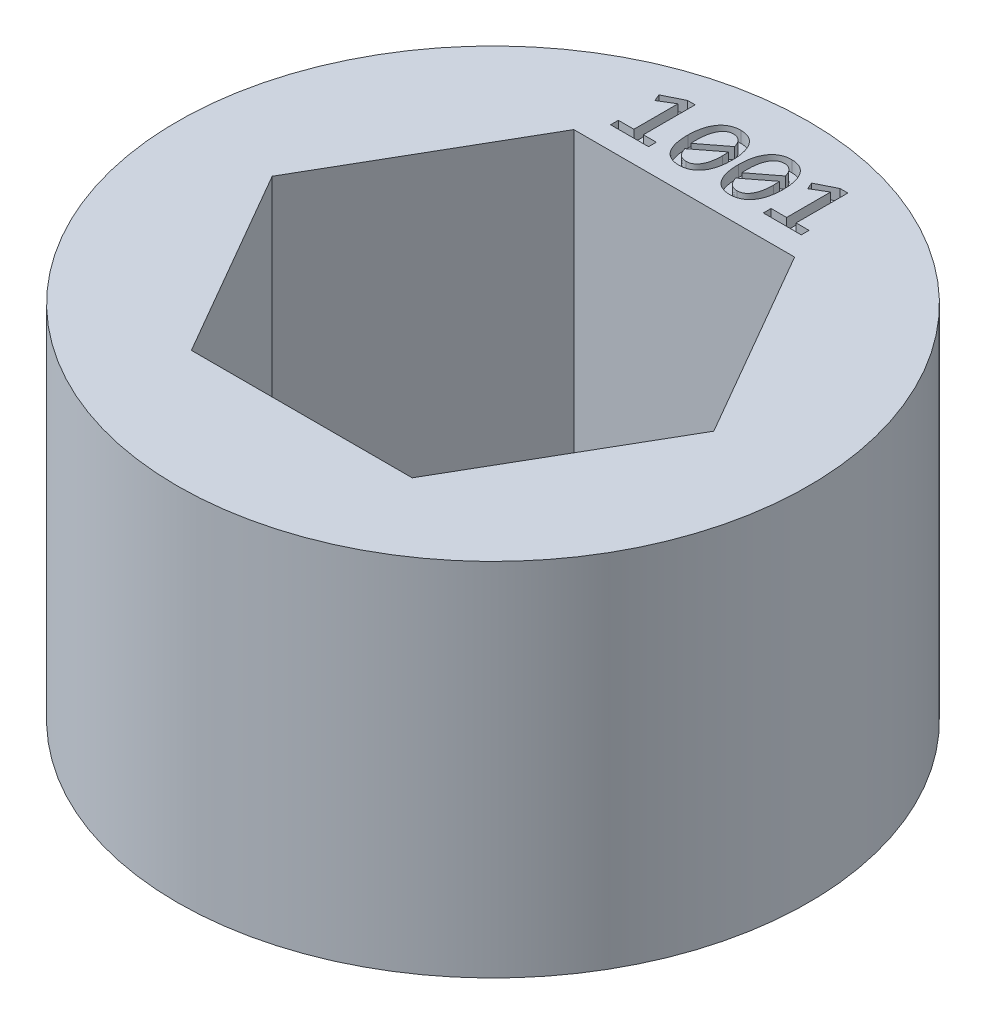
from build123d import *

# Parameters (mm, degrees)
SKETCH1_R           = 11.1125
BOSS_EXTRUDE1_DEPTH = 12.7
CUT_EXTRUDE1_DEPTH  = 0.4


with BuildPart() as part:
    # Sketch1 → Boss-Extrude1 (new body)
    with BuildSketch(Plane(origin=(0, 0, 0), x_dir=(1, 0, 0), z_dir=(0, 1, 0))):
        with Locations(Location((0, 0, 0), (0, 0, 270))):
            Circle(SKETCH1_R)
        Polygon((7.772289324, 0), (3.886144662, 6.731), (-3.886144662, 6.731), (-7.772289324, 0), (-3.886144662, -6.731), (3.886144662, -6.731), align=None, mode=Mode.SUBTRACT)
    extrude(amount=BOSS_EXTRUDE1_DEPTH)

    # Sketch2 → Cut-Extrude1 (cut)
    # profile 1 of 4: a face of its own
    with BuildSketch(Plane(origin=(0, 12.7, 0), x_dir=(1, 0, 0), z_dir=(0, 1, 0))):
        Polygon((-2.049251493, 7.52475), (-3.385828712, 7.52475), (-3.385828712, 7.798140795), (-2.839047122, 7.798140795), (-2.839047122, 9.347355299), (-3.343586037, 9.043587749), (-3.446582222, 9.286601789), (-2.776395065, 9.620746094), (-2.504902817, 9.620746094), (-2.504902817, 7.798140795), (-2.049251493, 7.798140795), align=None)
    # profile 2 of 4: a face of its own
    with BuildSketch(Plane(origin=(0, 12.7, 0), x_dir=(1, 0, 0), z_dir=(0, 1, 0))):
        with BuildLine():
            add(Edge.make_bspline(
                [(-0.165892684, 8.571798773), (-0.166325651, 8.532539667), (-0.167173732, 8.455640449), (-0.177140738, 8.343154692), (-0.192029215, 8.235790499), (-0.213292587, 8.133952321), (-0.240272581, 8.037990717), (-0.274910407, 7.94907057), (-0.314865217, 7.866804514), (-0.36154288, 7.791798506), (-0.414321619, 7.724560589), (-0.47324158, 7.664946723), (-0.538399911, 7.613533187), (-0.609814661, 7.570502981), (-0.68721939, 7.535730504), (-0.771505487, 7.511991642), (-0.861946132, 7.496719325), (-0.924455141, 7.495170599), (-0.956637587, 7.494373245)],
                knots=[0, 0, 0, 0, 1.248871528, 2.446241243, 3.590357027, 4.69618527, 5.754202854, 6.758290001, 7.728669934, 8.660396172, 9.563796911, 10.443071522, 11.321307858, 12.197637495, 13.090115231, 14.012601613, 14.976798049, 16, 16, 16, 16], degree=3))
            add(Edge.make_bspline(
                [(-0.956637587, 7.494373245), (-0.984523883, 7.495052085), (-1.039450838, 7.49638918), (-1.119857224, 7.508449964), (-1.196306294, 7.528578979), (-1.268936867, 7.555832092), (-1.33687734, 7.592268051), (-1.399769911, 7.637185139), (-1.457884215, 7.690364794), (-1.510227055, 7.752740329), (-1.557317942, 7.823677829), (-1.598168065, 7.90395186), (-1.633485499, 7.992818781), (-1.663637227, 8.090645609), (-1.686393921, 8.197912899), (-1.703489664, 8.314242635), (-1.713327632, 8.43999634), (-1.714500293, 8.526849228), (-1.715107188, 8.571798773)],
                knots=[0, 0, 0, 0, 0.897102697, 1.767001224, 2.609309556, 3.43771295, 4.257811968, 5.082953918, 5.919052252, 6.786174452, 7.6970727, 8.653553743, 9.679470751, 10.771494031, 11.944028827, 13.204944144, 14.553456404, 16, 16, 16, 16], degree=3))
            add(Edge.make_bspline(
                [(-1.715107188, 8.571798773), (-1.71439973, 8.61105018), (-1.713011452, 8.688075074), (-1.704182638, 8.80098373), (-1.688450082, 8.908608048), (-1.666850285, 9.010640269), (-1.638993202, 9.106716551), (-1.604965465, 9.195993499), (-1.56504748, 9.278286577), (-1.518887126, 9.353393458), (-1.466343023, 9.420893929), (-1.407260963, 9.480522767), (-1.342058547, 9.532107187), (-1.270210211, 9.574984835), (-1.192479257, 9.609682096), (-1.108222811, 9.633455575), (-1.01826503, 9.648757906), (-0.956228477, 9.650320298), (-0.924362285, 9.651122849)],
                knots=[0, 0, 0, 0, 1.248165713, 2.449334701, 3.598380242, 4.704508407, 5.763215836, 6.776019403, 7.739017366, 8.667464557, 9.574217704, 10.452902578, 11.330549874, 12.210601904, 13.107080692, 14.028948355, 14.987533857, 16, 16, 16, 16], degree=3))
            add(Edge.make_bspline(
                [(-0.924362285, 9.651122849), (-0.896475332, 9.65044401), (-0.841547085, 9.649106917), (-0.761301786, 9.637068879), (-0.684906628, 9.616988523), (-0.612566496, 9.588928446), (-0.544255062, 9.55306767), (-0.481529832, 9.507650243), (-0.423570481, 9.4541749), (-0.371366128, 9.391384812), (-0.324102603, 9.320190323), (-0.282877316, 9.240086592), (-0.247896786, 9.150892646), (-0.21811261, 9.053170973), (-0.194357973, 8.94609034), (-0.177578445, 8.829814678), (-0.16764054, 8.703922163), (-0.166489433, 8.616908067), (-0.165892684, 8.571798773)],
                knots=[0, 0, 0, 0, 0.896490568, 1.765795528, 2.602608418, 3.432274242, 4.256303472, 5.076742829, 5.915718828, 6.786140009, 7.696416714, 8.659101079, 9.677705081, 10.773848187, 11.941709476, 13.20176442, 14.549356535, 16, 16, 16, 16], degree=3))
        make_face()
        with BuildLine():
            add(Edge.make_bspline(
                [(-0.469660234, 8.555661122), (-0.469767537, 8.573863715), (-0.469981394, 8.610141868), (-0.474024404, 8.66420242), (-0.477403908, 8.717562964), (-0.480799232, 8.752800822), (-0.482475427, 8.770196954)],
                knots=[0, 0, 0, 0, 1.015676625, 2.024265076, 3.024624451, 4, 4, 4, 4], degree=3))
            Line((-0.482475427, 8.770196954), (-1.352010038, 8.101908345))
            add(Edge.make_bspline(
                [(-1.352010038, 8.101908345), (-1.34345071, 8.076265996), (-1.326662373, 8.025970882), (-1.294265101, 7.955066462), (-1.254555089, 7.89173888), (-1.206818183, 7.837824622), (-1.151314915, 7.794527876), (-1.099629529, 7.766900506), (-1.054544191, 7.751966897), (-1.018409114, 7.743163446), (-0.979846281, 7.738703342), (-0.953482359, 7.737832032), (-0.940025299, 7.737387285)],
                knots=[0, 0, 0, 0, 1.361870802, 2.671184605, 3.91877896, 5.116024374, 6.280451232, 7.450298556, 8.047911377, 8.670688444, 9.321473259, 10, 10, 10, 10], degree=3))
            add(Edge.make_bspline(
                [(-0.940025299, 7.737387285), (-0.922568023, 7.737990031), (-0.888151282, 7.739178334), (-0.837940335, 7.749690283), (-0.790019018, 7.765595868), (-0.744956902, 7.788922519), (-0.702437868, 7.81819234), (-0.664088949, 7.855043255), (-0.627980083, 7.897005683), (-0.595887758, 7.945833557), (-0.56696193, 8.000716962), (-0.54122657, 8.061797586), (-0.519690508, 8.129212654), (-0.501773845, 8.20284563), (-0.487029219, 8.282354818), (-0.476801204, 8.368116723), (-0.470554024, 8.459848262), (-0.469964364, 8.523058842), (-0.469660234, 8.555661122)],
                knots=[0, 0, 0, 0, 0.796240393, 1.569775284, 2.332781704, 3.095240773, 3.878796528, 4.681173991, 5.516437293, 6.40201063, 7.34239963, 8.345981007, 9.424260963, 10.57011489, 11.804224653, 13.114209461, 14.5115885, 16, 16, 16, 16], degree=3))
        make_face(mode=Mode.SUBTRACT)
        with BuildLine():
            add(Edge.make_bspline(
                [(-1.411339638, 8.575121231), (-1.411359377, 8.558192429), (-1.411398856, 8.524334087), (-1.411104532, 8.473852915), (-1.409430028, 8.424119907), (-1.406576912, 8.391427549), (-1.40516936, 8.375299139)],
                knots=[0, 0, 0, 0, 1.015676347, 2.03139705, 3.028811753, 4, 4, 4, 4], degree=3))
            Line((-1.40516936, 8.375299139), (-0.535160112, 9.043587749))
            add(Edge.make_bspline(
                [(-0.535160112, 9.043587749), (-0.543388282, 9.06962101), (-0.55938939, 9.120247212), (-0.593277284, 9.190237885), (-0.631981209, 9.253403948), (-0.679714875, 9.306455436), (-0.733736714, 9.350825781), (-0.785361246, 9.377733147), (-0.829524865, 9.3935938), (-0.864965959, 9.402303753), (-0.902414282, 9.406781166), (-0.927991087, 9.407661784), (-0.940974573, 9.408108809)],
                knots=[0, 0, 0, 0, 1.387569518, 2.698370158, 3.946895934, 5.144331536, 6.312393877, 7.486406228, 8.084826247, 8.697958228, 9.339048001, 10, 10, 10, 10], degree=3))
            add(Edge.make_bspline(
                [(-0.940974573, 9.408108809), (-0.958425679, 9.407488034), (-0.992830258, 9.406264186), (-1.04303389, 9.396031422), (-1.090739, 9.379139534), (-1.13598574, 9.355773608), (-1.178581811, 9.325843448), (-1.217031274, 9.288351162), (-1.253677288, 9.245695765), (-1.285520627, 9.19530522), (-1.314500544, 9.139278924), (-1.339775267, 9.076800562), (-1.361156549, 9.008131554), (-1.379940417, 8.933425934), (-1.393792523, 8.852471795), (-1.404251708, 8.765520689), (-1.410428728, 8.672353508), (-1.411029772, 8.60819695), (-1.411339638, 8.575121231)],
                knots=[0, 0, 0, 0, 0.786453526, 1.550480632, 2.299704824, 3.062398082, 3.840423392, 4.637837687, 5.478332318, 6.370910143, 7.318703432, 8.320397478, 9.40580758, 10.560070273, 11.791787257, 13.106920475, 14.508481623, 16, 16, 16, 16], degree=3))
        make_face(mode=Mode.SUBTRACT)
    # profile 3 of 4: a face of its own
    with BuildSketch(Plane(origin=(0, 12.7, 0), x_dir=(1, 0, 0), z_dir=(0, 1, 0))):
        with BuildLine():
            add(Edge.make_bspline(
                [(1.62633586, 8.571798773), (1.625902893, 8.532539667), (1.625054812, 8.455640449), (1.615087806, 8.343154692), (1.600199328, 8.235790499), (1.578935957, 8.133952321), (1.551955963, 8.037990717), (1.517318137, 7.94907057), (1.477363327, 7.866804514), (1.430685663, 7.791798506), (1.377906925, 7.724560589), (1.318986964, 7.664946723), (1.253828633, 7.613533187), (1.182413883, 7.570502981), (1.105009154, 7.535730504), (1.020723057, 7.511991642), (0.930282412, 7.496719325), (0.867773403, 7.495170599), (0.835590957, 7.494373245)],
                knots=[0, 0, 0, 0, 1.248871528, 2.446241243, 3.590357027, 4.69618527, 5.754202854, 6.758290001, 7.728669934, 8.660396172, 9.563796911, 10.443071522, 11.321307858, 12.197637495, 13.090115231, 14.012601613, 14.976798049, 16, 16, 16, 16], degree=3))
            add(Edge.make_bspline(
                [(0.835590957, 7.494373245), (0.807704661, 7.495052085), (0.752777706, 7.49638918), (0.67237132, 7.508449964), (0.59592225, 7.528578979), (0.523291677, 7.555832092), (0.455351204, 7.592268051), (0.392458633, 7.637185139), (0.334344328, 7.690364794), (0.282001489, 7.752740329), (0.234910602, 7.823677829), (0.194060479, 7.90395186), (0.158743045, 7.992818781), (0.128591317, 8.090645609), (0.105834623, 8.197912899), (0.08873888, 8.314242635), (0.078900912, 8.43999634), (0.077728251, 8.526849228), (0.077121356, 8.571798773)],
                knots=[0, 0, 0, 0, 0.897102697, 1.767001224, 2.609309556, 3.43771295, 4.257811968, 5.082953918, 5.919052252, 6.786174452, 7.6970727, 8.653553743, 9.679470751, 10.771494031, 11.944028827, 13.204944144, 14.553456404, 16, 16, 16, 16], degree=3))
            add(Edge.make_bspline(
                [(0.077121356, 8.571798773), (0.077828814, 8.61105018), (0.079217092, 8.688075074), (0.088045906, 8.80098373), (0.103778462, 8.908608048), (0.125378259, 9.010640269), (0.153235342, 9.106716551), (0.187263079, 9.195993499), (0.227181064, 9.278286577), (0.273341418, 9.353393458), (0.325885521, 9.420893929), (0.384967581, 9.480522767), (0.450169997, 9.532107187), (0.522018333, 9.574984835), (0.599749287, 9.609682096), (0.684005733, 9.633455575), (0.773963514, 9.648757906), (0.836000067, 9.650320298), (0.867866259, 9.651122849)],
                knots=[0, 0, 0, 0, 1.248165713, 2.449334701, 3.598380242, 4.704508407, 5.763215836, 6.776019403, 7.739017366, 8.667464557, 9.574217704, 10.452902578, 11.330549874, 12.210601904, 13.107080692, 14.028948355, 14.987533857, 16, 16, 16, 16], degree=3))
            add(Edge.make_bspline(
                [(0.867866259, 9.651122849), (0.895753212, 9.65044401), (0.950681459, 9.649106917), (1.030926758, 9.637068879), (1.107321916, 9.616988523), (1.179662048, 9.588928446), (1.247973482, 9.55306767), (1.310698712, 9.507650243), (1.368658063, 9.4541749), (1.420862416, 9.391384812), (1.468125941, 9.320190323), (1.509351228, 9.240086592), (1.544331758, 9.150892646), (1.574115934, 9.053170973), (1.597870571, 8.94609034), (1.614650099, 8.829814678), (1.624588004, 8.703922163), (1.625739111, 8.616908067), (1.62633586, 8.571798773)],
                knots=[0, 0, 0, 0, 0.896490568, 1.765795528, 2.602608418, 3.432274242, 4.256303472, 5.076742829, 5.915718828, 6.786140009, 7.696416714, 8.659101079, 9.677705081, 10.773848187, 11.941709476, 13.20176442, 14.549356535, 16, 16, 16, 16], degree=3))
        make_face()
        with BuildLine():
            add(Edge.make_bspline(
                [(1.32256831, 8.555661122), (1.322461007, 8.573863715), (1.322247149, 8.610141868), (1.31820414, 8.66420242), (1.314824636, 8.717562964), (1.311429311, 8.752800822), (1.309753117, 8.770196954)],
                knots=[0, 0, 0, 0, 1.015676625, 2.024265076, 3.024624451, 4, 4, 4, 4], degree=3))
            Line((1.309753117, 8.770196954), (0.440218505, 8.101908345))
            add(Edge.make_bspline(
                [(0.440218505, 8.101908345), (0.448777834, 8.076265996), (0.465566171, 8.025970882), (0.497963443, 7.955066462), (0.537673455, 7.89173888), (0.585410361, 7.837824622), (0.640913629, 7.794527876), (0.692599015, 7.766900506), (0.737684353, 7.751966897), (0.77381943, 7.743163446), (0.812382263, 7.738703342), (0.838746185, 7.737832032), (0.852203245, 7.737387285)],
                knots=[0, 0, 0, 0, 1.361870802, 2.671184605, 3.91877896, 5.116024374, 6.280451232, 7.450298556, 8.047911377, 8.670688444, 9.321473259, 10, 10, 10, 10], degree=3))
            add(Edge.make_bspline(
                [(0.852203245, 7.737387285), (0.86966052, 7.737990031), (0.904077262, 7.739178334), (0.954288209, 7.749690283), (1.002209526, 7.765595868), (1.047271642, 7.788922519), (1.089790676, 7.81819234), (1.128139595, 7.855043255), (1.164248461, 7.897005683), (1.196340786, 7.945833557), (1.225266614, 8.000716962), (1.251001974, 8.061797586), (1.272538036, 8.129212654), (1.290454699, 8.20284563), (1.305199325, 8.282354818), (1.31542734, 8.368116723), (1.32167452, 8.459848262), (1.32226418, 8.523058842), (1.32256831, 8.555661122)],
                knots=[0, 0, 0, 0, 0.796240393, 1.569775284, 2.332781704, 3.095240773, 3.878796528, 4.681173991, 5.516437293, 6.40201063, 7.34239963, 8.345981007, 9.424260963, 10.57011489, 11.804224653, 13.114209461, 14.5115885, 16, 16, 16, 16], degree=3))
        make_face(mode=Mode.SUBTRACT)
        with BuildLine():
            add(Edge.make_bspline(
                [(0.380888906, 8.575121231), (0.380869167, 8.558192429), (0.380829688, 8.524334087), (0.381124012, 8.473852915), (0.382798516, 8.424119907), (0.385651632, 8.391427549), (0.387059184, 8.375299139)],
                knots=[0, 0, 0, 0, 1.015676347, 2.03139705, 3.028811753, 4, 4, 4, 4], degree=3))
            Line((0.387059184, 8.375299139), (1.257068432, 9.043587749))
            add(Edge.make_bspline(
                [(1.257068432, 9.043587749), (1.248840262, 9.06962101), (1.232839154, 9.120247212), (1.19895126, 9.190237885), (1.160247335, 9.253403948), (1.112513669, 9.306455436), (1.05849183, 9.350825781), (1.006867298, 9.377733147), (0.962703679, 9.3935938), (0.927262585, 9.402303753), (0.889814262, 9.406781166), (0.864237457, 9.407661784), (0.851253971, 9.408108809)],
                knots=[0, 0, 0, 0, 1.387569518, 2.698370158, 3.946895934, 5.144331536, 6.312393877, 7.486406228, 8.084826247, 8.697958228, 9.339048001, 10, 10, 10, 10], degree=3))
            add(Edge.make_bspline(
                [(0.851253971, 9.408108809), (0.833802865, 9.407488034), (0.799398286, 9.406264186), (0.749194653, 9.396031422), (0.701489544, 9.379139534), (0.656242804, 9.355773608), (0.613646733, 9.325843448), (0.57519727, 9.288351162), (0.538551256, 9.245695765), (0.506707917, 9.19530522), (0.477728, 9.139278924), (0.452453277, 9.076800562), (0.431071995, 9.008131554), (0.412288127, 8.933425934), (0.398436021, 8.852471795), (0.387976836, 8.765520689), (0.381799816, 8.672353508), (0.381198772, 8.60819695), (0.380888906, 8.575121231)],
                knots=[0, 0, 0, 0, 0.786453526, 1.550480632, 2.299704824, 3.062398082, 3.840423392, 4.637837687, 5.478332318, 6.370910143, 7.318703432, 8.320397478, 9.40580758, 10.560070273, 11.791787257, 13.106920475, 14.508481623, 16, 16, 16, 16], degree=3))
        make_face(mode=Mode.SUBTRACT)
    # profile 4 of 4: a face of its own
    with BuildSketch(Plane(origin=(0, 12.7, 0), x_dir=(1, 0, 0), z_dir=(0, 1, 0))):
        Polygon((3.327434139, 7.52475), (1.99085692, 7.52475), (1.99085692, 7.798140795), (2.53763851, 7.798140795), (2.53763851, 9.347355299), (2.033099595, 9.043587749), (1.93010341, 9.286601789), (2.600290567, 9.620746094), (2.871782814, 9.620746094), (2.871782814, 7.798140795), (3.327434139, 7.798140795), align=None)
    extrude(amount=-CUT_EXTRUDE1_DEPTH, mode=Mode.SUBTRACT)


solid = part.part
